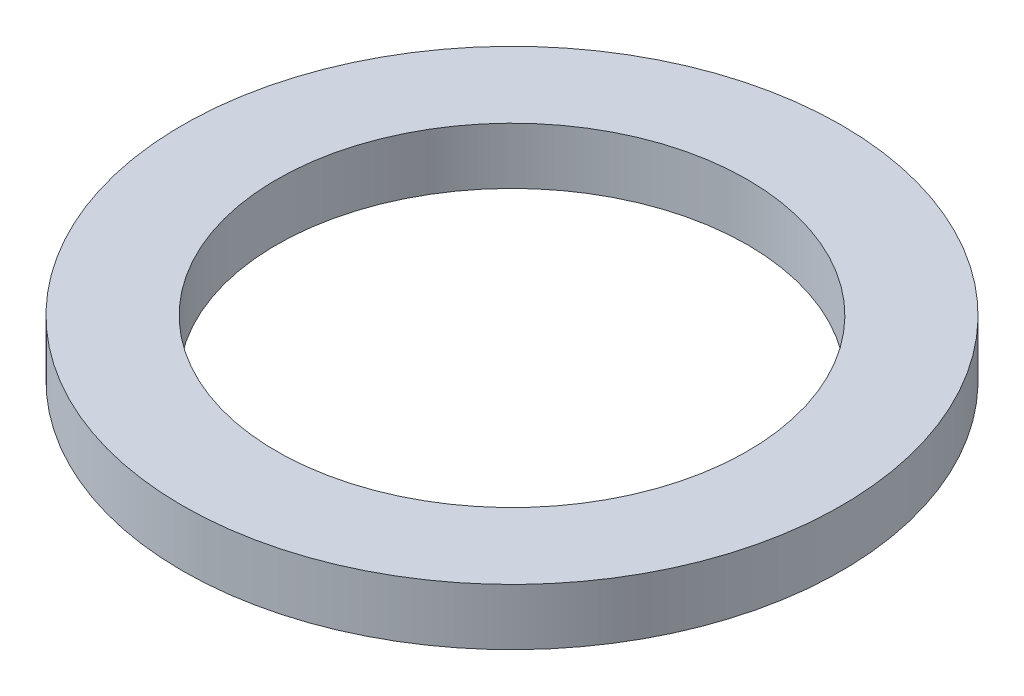
from build123d import *

# Parameters (mm, degrees)
SKETCH1_R           = 22.225
SKETCH1_R_2         = 15.875
BOSS_EXTRUDE1_DEPTH = 3.81


with BuildPart() as part:
    # Sketch1 → Boss-Extrude1 (new body)
    with BuildSketch(Plane(origin=(0, 0, 0), x_dir=(1, 0, 0), z_dir=(0, 1, 0))):
        with Locations(Location((0, 0, 0), (0, 0, 90))):
            Circle(SKETCH1_R)
        with Locations(Location((0, 0, 0), (0, 0, 90))):
            Circle(SKETCH1_R_2, mode=Mode.SUBTRACT)
    extrude(amount=BOSS_EXTRUDE1_DEPTH)


solid = part.part
